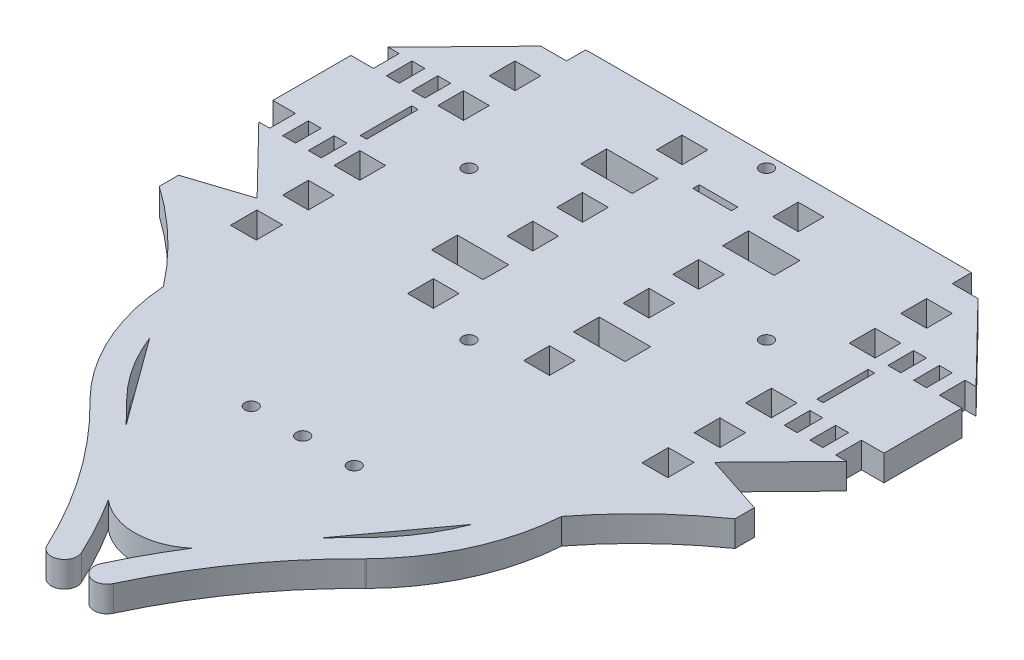
from build123d import *

# Parameters (mm, degrees)
SKETCH1_R           = 1.5875
SKETCH1_W           = 6.35
SKETCH1_H           = 6.29999034
SKETCH1_H_2         = 6.35
SKETCH1_H_3         = 12.7
SKETCH1_H_4         = 6.5024
SKETCH1_W_2         = 3.175
SKETCH1_W_3         = 12.7
SKETCH1_W_4         = 1.5875
SKETCH1_W_5         = 9.525
SKETCH1_H_5         = 1.5875
BOSS_EXTRUDE1_DEPTH = 6.35
CUT_EXTRUDE1_DEPTH  = 205.960516657
SKETCH3_W           = 6.35
SKETCH3_H           = 12.7
BOSS_EXTRUDE2_DEPTH = 2.54


with BuildPart() as part:
    # Sketch1 → Boss-Extrude1 (new body)
    with BuildSketch(Plane(origin=(0, 0, 0), x_dir=(1, 0, 0), z_dir=(0, 1, 0))):
        with BuildLine():
            Line((-75.354103327, 160.3375), (-75.354103327, 141.111598604))
            Line((-75.354103327, 141.111598604), (-69.7992, 141.111598604))
            Line((-69.7992, 141.111598604), (-69.7992, 134.761598604))
            Line((-69.7992, 134.761598604), (-72.497141996, 134.761598604))
            Line((-72.497141996, 134.761598604), (-56.400592266, 118.251598604))
            Line((-56.400592266, 118.251598604), (-71.014328069, 118.251598604))
            Line((-71.014328069, 118.251598604), (-71.014328069, 108.73195884))
            ThreePointArc((-71.014328069, 108.73195884), (-59.282147709, 99.113796407), (-49.112923406, 87.855911097))
            ThreePointArc((-49.112923406, 87.855911097), (-44.547034021, 69.954516565), (-34.085481344, 54.727462102))
            ThreePointArc((-34.085481344, 54.727462102), (-34.010774011, 54.646493601), (-33.933325236, 54.568143291))
            ThreePointArc((-33.933325236, 54.568143291), (-19.41618536, 37.5648822), (-8.182684213, 18.234422043))
            ThreePointArc((-8.182684213, 18.234422043), (-3.927924594, 16.685655735), (-2.379158286, 20.940415354))
            ThreePointArc((-2.379158286, 20.940415354), (-6.112848184, 28.327387461), (-10.306959103, 35.463018532))
            ThreePointArc((-10.306959103, 35.463018532), (0, 31.683005169), (10.306959103, 35.463018532))
            ThreePointArc((10.306959103, 35.463018532), (6.112848184, 28.327387461), (2.379158286, 20.940415354))
            ThreePointArc((2.379158286, 20.940415354), (3.927924594, 16.685655735), (8.182684213, 18.234422043))
            ThreePointArc((8.182684213, 18.234422043), (19.41618536, 37.5648822), (33.933325236, 54.568143291))
            ThreePointArc((33.933325236, 54.568143291), (34.010774011, 54.646493601), (34.085481344, 54.727462102))
            ThreePointArc((34.085481344, 54.727462102), (44.547034021, 69.954516565), (49.112923406, 87.855911097))
            ThreePointArc((49.112923406, 87.855911097), (59.282147709, 99.113796407), (71.014328069, 108.73195884))
            Line((71.014328069, 108.73195884), (71.014328069, 118.251598604))
            Line((71.014328069, 118.251598604), (56.400592266, 118.251598604))
            Line((56.400592266, 118.251598604), (72.497141996, 134.761598604))
            Line((72.497141996, 134.761598604), (69.7992, 134.761598604))
            Line((69.7992, 134.761598604), (69.7992, 141.111598604))
            Line((69.7992, 141.111598604), (75.354103327, 141.111598604))
            Line((75.354103327, 141.111598604), (75.354103327, 160.3375))
            Line((75.354103327, 160.3375), (69.7992, 160.3375))
            Line((69.7992, 160.3375), (69.7992, 166.6875))
            Line((69.7992, 166.6875), (72.497141996, 166.6875))
            Line((72.497141996, 166.6875), (53.9242, 185.7375))
            Line((53.9242, 185.7375), (47.5742, 185.7375))
            Line((47.5742, 185.7375), (47.5742, 190.445328699))
            ThreePointArc((47.5742, 190.445328699), (46.396423803, 190.486330336), (45.218013414, 190.5))
            Line((45.218013414, 190.5), (-45.218013414, 190.5))
            ThreePointArc((-45.218013414, 190.5), (-46.396423803, 190.486330336), (-47.5742, 190.445328699))
            Line((-47.5742, 190.445328699), (-47.5742, 185.7375))
            Line((-47.5742, 185.7375), (-53.9242, 185.7375))
            Line((-53.9242, 185.7375), (-72.497141996, 166.6875))
            Line((-72.497141996, 166.6875), (-69.7992, 166.6875))
            Line((-69.7992, 166.6875), (-69.7992, 160.3375))
            Line((-69.7992, 160.3375), (-75.354103327, 160.3375))
        make_face()
        with Locations(Location((0, 114.124098604, 0), (0, 0, 270))):
            Circle(SKETCH1_R, mode=Mode.SUBTRACT)
        with Locations(Location((-36.688401396, 150.8125, 0), (0, 0, 270))):
            Circle(SKETCH1_R, mode=Mode.SUBTRACT)
        with Locations(Location((0, 73.103098604, 0), (0, 0, 270))):
            Circle(SKETCH1_R, mode=Mode.SUBTRACT)
        with Locations(Location((12.7, 73.103098604, 0), (0, 0, 270))):
            Circle(SKETCH1_R, mode=Mode.SUBTRACT)
        with Locations(Location((0, 187.500901396, 0), (0, 0, 270))):
            Circle(SKETCH1_R, mode=Mode.SUBTRACT)
        with Locations(Location((36.688401396, 150.8125, 0), (0, 0, 270))):
            Circle(SKETCH1_R, mode=Mode.SUBTRACT)
        with Locations(Location((-12.7, 73.103098604, 0), (0, 0, 270))):
            Circle(SKETCH1_R, mode=Mode.SUBTRACT)
        with Locations((-14.3256, 181.00000483)):
            Rectangle(SKETCH1_W, SKETCH1_H, mode=Mode.SUBTRACT)
        with Locations((50.7492, 176.2125)):
            Rectangle(SKETCH1_W, SKETCH1_H_2, mode=Mode.SUBTRACT)
        with Locations((50.7492, 163.5125)):
            Rectangle(SKETCH1_W, SKETCH1_H_2, mode=Mode.SUBTRACT)
        with BuildLine():
            Line((-39.792272874, 75.153387791), (-23.924743791, 53.398875044))
            ThreePointArc((-23.924743791, 53.398875044), (-26.647187913, 56.315410311), (-29.457448156, 59.147426788))
            ThreePointArc((-29.457448156, 59.147426788), (-29.497282945, 59.185695722), (-29.537772034, 59.223271716))
            ThreePointArc((-29.537772034, 59.223271716), (-35.488056799, 66.658527815), (-39.792272874, 75.153387791))
        make_face(mode=Mode.SUBTRACT)
        with Locations((50.7492, 137.936598604)):
            Rectangle(SKETCH1_W, SKETCH1_H_2, mode=Mode.SUBTRACT)
        with Locations((50.7492, 125.236598604)):
            Rectangle(SKETCH1_W, SKETCH1_H_2, mode=Mode.SUBTRACT)
        with Locations((-24.9174, 112.259548641)):
            Rectangle(SKETCH1_W, SKETCH1_H_3, mode=Mode.SUBTRACT)
        with Locations((24.9174, 112.259548641)):
            Rectangle(SKETCH1_W, SKETCH1_H_3, mode=Mode.SUBTRACT)
        with Locations((14.3256, 119.634)):
            Rectangle(SKETCH1_W, SKETCH1_H_2, mode=Mode.SUBTRACT)
        with Locations((14.3256, 144.1704)):
            Rectangle(SKETCH1_W, SKETCH1_H_2, mode=Mode.SUBTRACT)
        with Locations((24.9174, 73.118148641)):
            Rectangle(SKETCH1_W, SKETCH1_H_3, mode=Mode.SUBTRACT)
        with Locations((-24.9174, 73.118148641)):
            Rectangle(SKETCH1_W, SKETCH1_H_3, mode=Mode.SUBTRACT)
        with Locations((14.3256, 156.4386)):
            Rectangle(SKETCH1_W, SKETCH1_H_2, mode=Mode.SUBTRACT)
        with Locations((-14.3256, 156.4386)):
            Rectangle(SKETCH1_W, SKETCH1_H_2, mode=Mode.SUBTRACT)
        with Locations((-50.7492, 176.2125)):
            Rectangle(SKETCH1_W, SKETCH1_H_2, mode=Mode.SUBTRACT)
        with Locations((-50.7492, 163.5125)):
            Rectangle(SKETCH1_W, SKETCH1_H_2, mode=Mode.SUBTRACT)
        with Locations((-50.7492, 112.460398604)):
            Rectangle(SKETCH1_W, SKETCH1_H_4, mode=Mode.SUBTRACT)
        with Locations((-50.7492, 137.936598604)):
            Rectangle(SKETCH1_W, SKETCH1_H_2, mode=Mode.SUBTRACT)
        with Locations((-50.7492, 125.236598604)):
            Rectangle(SKETCH1_W, SKETCH1_H_2, mode=Mode.SUBTRACT)
        with Locations((-58.6867, 137.936598604)):
            Rectangle(SKETCH1_W_2, SKETCH1_H_2, mode=Mode.SUBTRACT)
        with Locations((50.7492, 112.460398604)):
            Rectangle(SKETCH1_W, SKETCH1_H_4, mode=Mode.SUBTRACT)
        with Locations((-65.0367, 137.936598604)):
            Rectangle(SKETCH1_W_2, SKETCH1_H_2, mode=Mode.SUBTRACT)
        with Locations((-14.3256, 144.1704)):
            Rectangle(SKETCH1_W, SKETCH1_H_2, mode=Mode.SUBTRACT)
        with Locations((-14.3256, 119.634)):
            Rectangle(SKETCH1_W, SKETCH1_H_2, mode=Mode.SUBTRACT)
        with Locations((17.5006, 168.7068)):
            Rectangle(SKETCH1_W_3, SKETCH1_H_2, mode=Mode.SUBTRACT)
        with Locations((-17.5006, 168.7068)):
            Rectangle(SKETCH1_W_3, SKETCH1_H_2, mode=Mode.SUBTRACT)
        with Locations((-17.5006, 131.9022)):
            Rectangle(SKETCH1_W_3, SKETCH1_H_2, mode=Mode.SUBTRACT)
        with Locations((17.5006, 131.9022)):
            Rectangle(SKETCH1_W_3, SKETCH1_H_2, mode=Mode.SUBTRACT)
        with Locations((14.3256, 181.00000483)):
            Rectangle(SKETCH1_W, SKETCH1_H, mode=Mode.SUBTRACT)
        with Locations((58.6867, 163.5125)):
            Rectangle(SKETCH1_W_2, SKETCH1_H_2, mode=Mode.SUBTRACT)
        with Locations((65.0367, 163.5125)):
            Rectangle(SKETCH1_W_2, SKETCH1_H_2, mode=Mode.SUBTRACT)
        with Locations((65.0367, 137.936598604)):
            Rectangle(SKETCH1_W_2, SKETCH1_H_2, mode=Mode.SUBTRACT)
        with Locations((58.6867, 137.936598604)):
            Rectangle(SKETCH1_W_2, SKETCH1_H_2, mode=Mode.SUBTRACT)
        with Locations((-65.0367, 163.5125)):
            Rectangle(SKETCH1_W_2, SKETCH1_H_2, mode=Mode.SUBTRACT)
        with Locations((-58.6867, 163.5125)):
            Rectangle(SKETCH1_W_2, SKETCH1_H_2, mode=Mode.SUBTRACT)
        with BuildLine():
            Line((39.792272874, 75.153387791), (23.924743791, 53.398875044))
            ThreePointArc((23.924743791, 53.398875044), (26.647187913, 56.315410311), (29.457448156, 59.147426788))
            ThreePointArc((29.457448156, 59.147426788), (29.497282945, 59.185695722), (29.537772034, 59.223271716))
            ThreePointArc((29.537772034, 59.223271716), (35.488056799, 66.658527815), (39.792272874, 75.153387791))
        make_face(mode=Mode.SUBTRACT)
        with Locations((56.30545, 150.724549302)):
            Rectangle(SKETCH1_W_4, SKETCH1_H_3, mode=Mode.SUBTRACT)
        with Locations((-56.30545, 150.724549302)):
            Rectangle(SKETCH1_W_4, SKETCH1_H_3, mode=Mode.SUBTRACT)
        with Locations((0, 174.86590483)):
            Rectangle(SKETCH1_W_5, SKETCH1_H_5, mode=Mode.SUBTRACT)
    extrude(amount=BOSS_EXTRUDE1_DEPTH)

    # Sketch2 → Cut-Extrude1 (cut, through all)
    with BuildSketch(Plane(origin=(0, 6.35, 0), x_dir=(1, 0, 0), z_dir=(0, 1, 0))):
        Polygon((-56.400592266, 118.251598604), (-71.014328069, 118.251598604), (-71.014328069, 113.491778722), align=None)
        Polygon((71.014328069, 113.491778722), (56.400592266, 118.251598604), (71.014328069, 118.251598604), align=None)
    extrude(amount=-CUT_EXTRUDE1_DEPTH, mode=Mode.SUBTRACT)

    # Sketch3 → Boss-Extrude2 (add)
    with BuildSketch(Plane(origin=(0, 6.35, 0), x_dir=(1, 0, 0), z_dir=(0, 1, 0))):
        with Locations((-24.9174, 112.259548641)):
            Rectangle(SKETCH3_W, SKETCH3_H)
        with Locations((24.9174, 112.259548641)):
            Rectangle(SKETCH3_W, SKETCH3_H)
        with Locations((24.9174, 73.118148641)):
            Rectangle(SKETCH3_W, SKETCH3_H)
        with Locations((-24.9174, 73.118148641)):
            Rectangle(SKETCH3_W, SKETCH3_H)
    extrude(amount=-BOSS_EXTRUDE2_DEPTH)


solid = part.part
